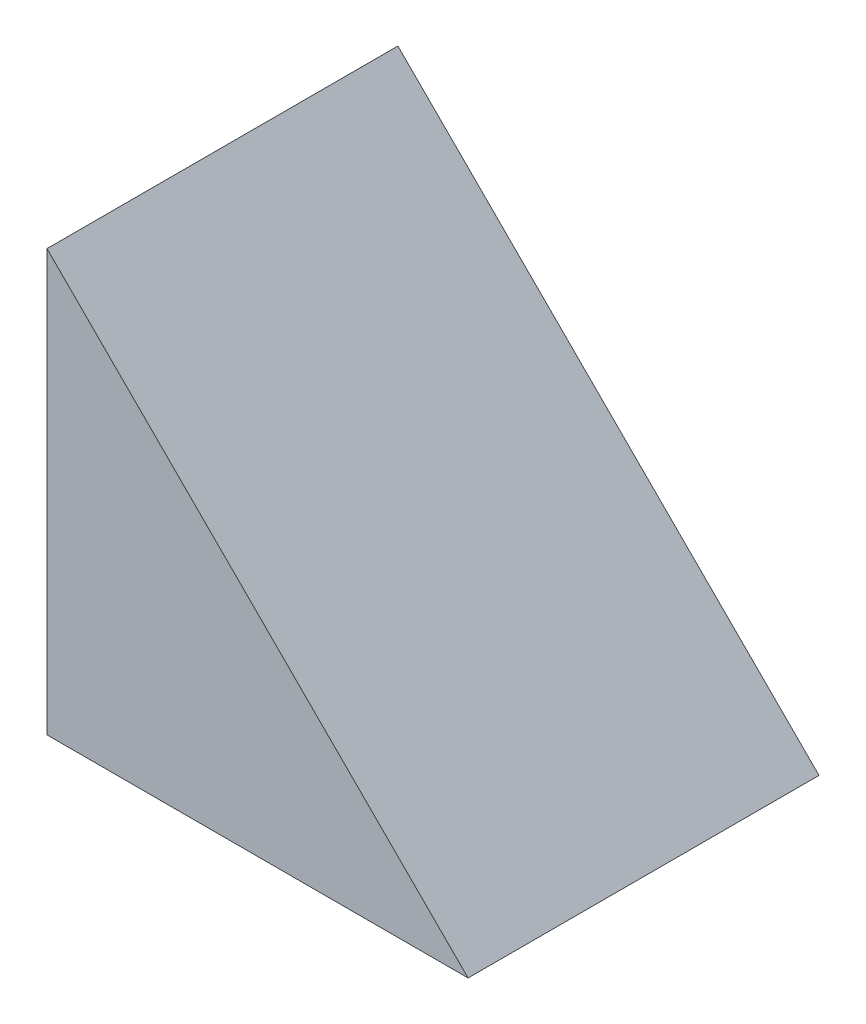
from build123d import *

# Parameters (mm, degrees)
EXTRUDE_1_DEPTH = 63.5


with BuildPart() as part:
    # 草图1 → 凸台-拉伸1 (new body)
    with BuildSketch(Plane.XY):
        Polygon((0, 0), (76.2, 0), (0, 76.2), align=None)
    extrude(amount=EXTRUDE_1_DEPTH)


solid = part.part
